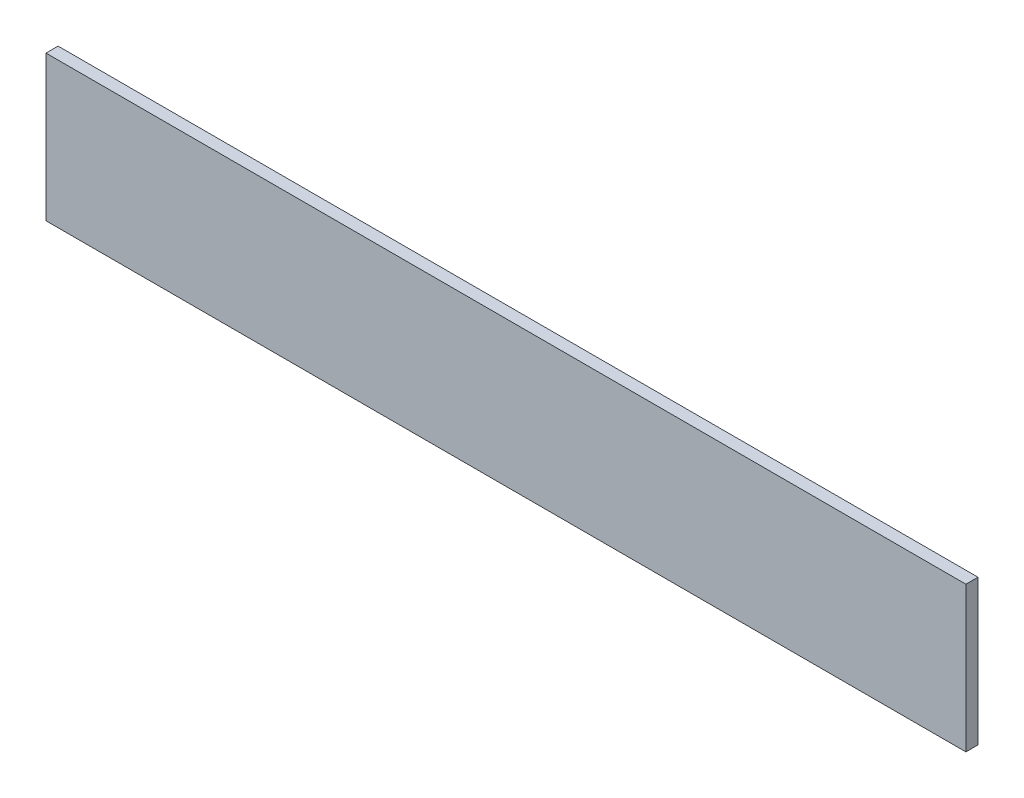
from build123d import *

# Parameters (mm, degrees)
SKETCH1_W           = 76
SKETCH1_H           = 12
BOSS_EXTRUDE1_DEPTH = 1


with BuildPart() as part:
    # Sketch1 → Boss-Extrude1 (new body)
    with BuildSketch(Plane.XY.offset(24)):
        with Locations((0, -40)):
            Rectangle(SKETCH1_W, SKETCH1_H)
    extrude(amount=BOSS_EXTRUDE1_DEPTH)


solid = part.part
